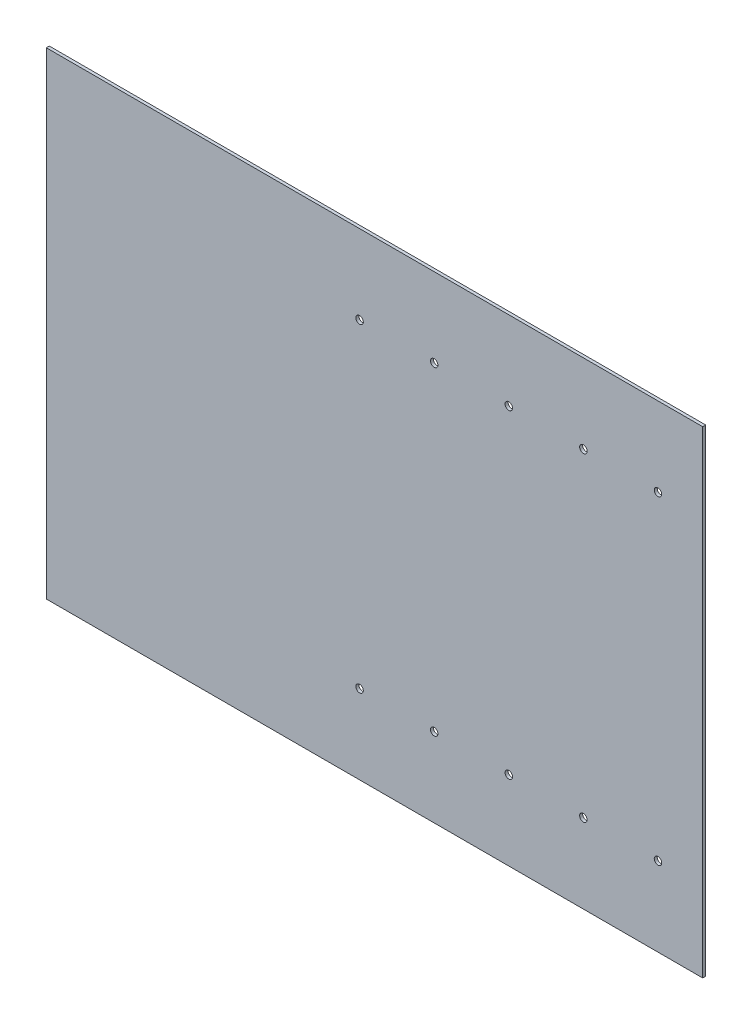
from build123d import *

# Parameters (mm, degrees)
SKETCH_1_W          = 440
SKETCH_1_H          = 320
EXTRUDE_1_DEPTH     = 2
SKETCH_2_R          = 2.5
CUT_EXTRUDE_1_DEPTH = 10


with BuildPart() as part:
    # 草图1 → 凸台-拉伸1 (new body)
    with BuildSketch(Plane.XY):
        Rectangle(SKETCH_1_W, SKETCH_1_H)
    extrude(amount=EXTRUDE_1_DEPTH)

    # 草图2 → 切除-拉伸1 (cut)
    with BuildSketch(Plane.XY.offset(2)):
        with Locations((190, 107)):
            Circle(SKETCH_2_R)
        with Locations((140, 107)):
            Circle(SKETCH_2_R)
        with Locations((90, 107)):
            Circle(SKETCH_2_R)
        with Locations((40, 107)):
            Circle(SKETCH_2_R)
        with Locations((-10, 107)):
            Circle(SKETCH_2_R)
        with Locations((-10, -107)):
            Circle(SKETCH_2_R)
        with Locations((40, -107)):
            Circle(SKETCH_2_R)
        with Locations((90, -107)):
            Circle(SKETCH_2_R)
        with Locations((140, -107)):
            Circle(SKETCH_2_R)
        with Locations((190, -107)):
            Circle(SKETCH_2_R)
    extrude(amount=-CUT_EXTRUDE_1_DEPTH, mode=Mode.SUBTRACT)


solid = part.part
